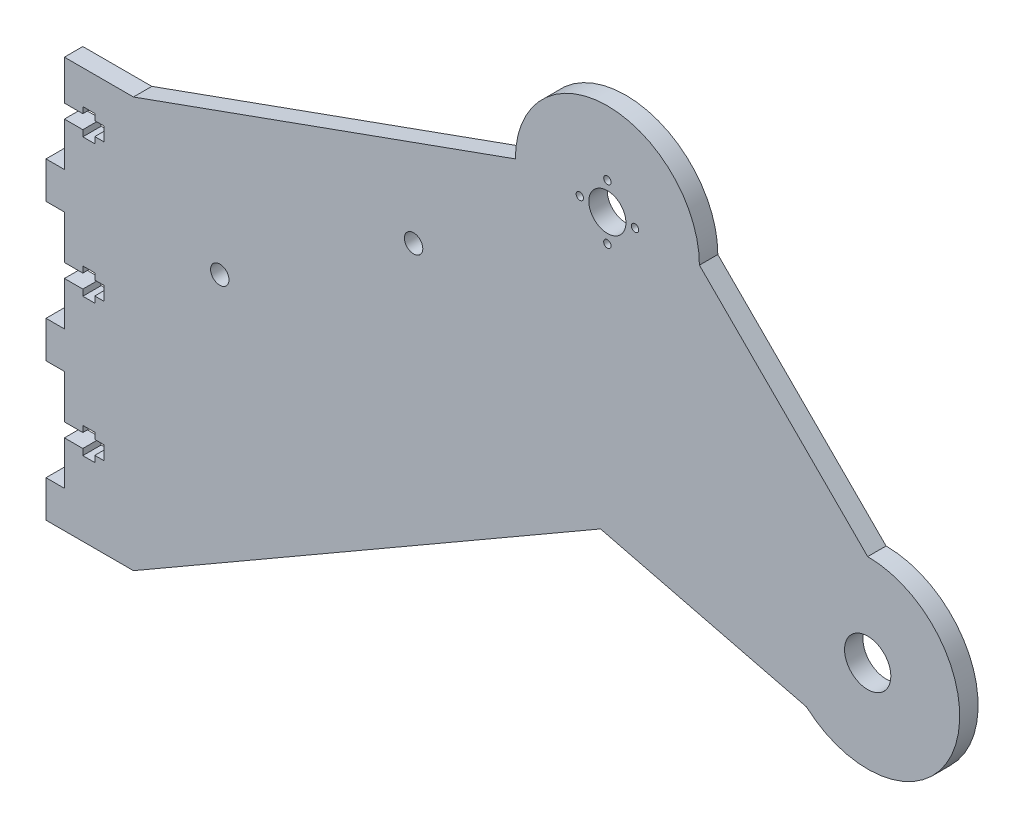
from build123d import *

# Parameters (mm, degrees)
SKETCH_1_R      = 2
SKETCH_1_R_2    = 5.03
SKETCH_1_R_3    = 0.8
SKETCH_1_R_4    = 4.03
EXTRUDE_1_DEPTH = 4


with BuildPart() as part:
    # 草图1 → 凸台-拉伸1 (new body)
    with BuildSketch(Plane.XY):
        with BuildLine():
            Line((2.282857143, -22.113571429), (-1.717142857, -22.113571429))
            Line((-1.717142857, -22.113571429), (-1.717142857, -31.613571429))
            Line((-1.717142857, -31.613571429), (-5.717142857, -31.613571429))
            Line((-5.717142857, -31.613571429), (-5.717142857, -39.613571429))
            Line((-5.717142857, -39.613571429), (-1.717142857, -39.613571429))
            Line((-1.717142857, -39.613571429), (13.282857143, -39.613571429))
            Line((13.282857143, -39.613571429), (114.795824144, 18.994967396))
            Line((114.795824144, 18.994967396), (159.545326709, 7.886428571))
            ThreePointArc((159.545326709, 7.886428571), (191.541358842, 15.698516375), (172.851399638, 42.817886077))
            Line((172.851399638, 42.817886077), (136.282857143, 79.386428571))
            ThreePointArc((136.282857143, 79.386428571), (116.282857143, 99.386428571), (96.282857143, 79.386428571))
            Line((96.282857143, 79.386428571), (13.282857143, 49.538084372))
            Line((13.282857143, 49.538084372), (-1.717142857, 49.538084372))
            Line((-1.717142857, 49.538084372), (-1.717142857, 40.886428571))
            Line((-1.717142857, 40.886428571), (2.282857143, 40.886428571))
            Line((2.282857143, 40.886428571), (2.282857143, 42.236428571))
            Line((2.282857143, 42.236428571), (4.882857143, 42.236428571))
            Line((4.882857143, 42.236428571), (4.882857143, 40.886428571))
            Line((4.882857143, 40.886428571), (6.882857143, 40.886428571))
            Line((6.882857143, 40.886428571), (6.882857143, 37.886428571))
            Line((6.882857143, 37.886428571), (4.882857143, 37.886428571))
            Line((4.882857143, 37.886428571), (4.882857143, 36.536428571))
            Line((4.882857143, 36.536428571), (2.282857143, 36.536428571))
            Line((2.282857143, 36.536428571), (2.282857143, 37.886428571))
            Line((2.282857143, 37.886428571), (-1.717142857, 37.886428571))
            Line((-1.717142857, 37.886428571), (-1.717142857, 28.386428571))
            Line((-1.717142857, 28.386428571), (-5.717142857, 28.386428571))
            Line((-5.717142857, 28.386428571), (-5.717142857, 20.386428571))
            Line((-5.717142857, 20.386428571), (-1.717142857, 20.386428571))
            Line((-1.717142857, 20.386428571), (-1.717142857, 10.886428571))
            Line((-1.717142857, 10.886428571), (2.282857143, 10.886428571))
            Line((2.282857143, 10.886428571), (2.282857143, 12.236428571))
            Line((2.282857143, 12.236428571), (4.882857143, 12.236428571))
            Line((4.882857143, 12.236428571), (4.882857143, 10.886428571))
            Line((4.882857143, 10.886428571), (6.882857143, 10.886428571))
            Line((6.882857143, 10.886428571), (6.882857143, 7.886428571))
            Line((6.882857143, 7.886428571), (4.882857143, 7.886428571))
            Line((4.882857143, 7.886428571), (4.882857143, 6.536428571))
            Line((4.882857143, 6.536428571), (2.282857143, 6.536428571))
            Line((2.282857143, 6.536428571), (2.282857143, 7.886428571))
            Line((2.282857143, 7.886428571), (-1.717142857, 7.886428571))
            Line((-1.717142857, 7.886428571), (-1.717142857, -1.613571429))
            Line((-1.717142857, -1.613571429), (-5.717142857, -1.613571429))
            Line((-5.717142857, -1.613571429), (-5.717142857, -9.613571429))
            Line((-5.717142857, -9.613571429), (-1.717142857, -9.613571429))
            Line((-1.717142857, -9.613571429), (-1.717142857, -19.113571429))
            Line((-1.717142857, -19.113571429), (2.282857143, -19.113571429))
            Line((2.282857143, -19.113571429), (2.282857143, -17.763571429))
            Line((2.282857143, -17.763571429), (4.882857143, -17.763571429))
            Line((4.882857143, -17.763571429), (4.882857143, -19.113571429))
            Line((4.882857143, -19.113571429), (6.882857143, -19.113571429))
            Line((6.882857143, -19.113571429), (6.882857143, -22.113571429))
            Line((6.882857143, -22.113571429), (4.882857143, -22.113571429))
            Line((4.882857143, -22.113571429), (4.882857143, -23.463571429))
            Line((4.882857143, -23.463571429), (2.282857143, -23.463571429))
            Line((2.282857143, -23.463571429), (2.282857143, -22.113571429))
        make_face()
        with Locations((32.050124236, 25.489798741)):
            Circle(SKETCH_1_R, mode=Mode.SUBTRACT)
        with Locations((172.851399638, 22.817886077)):
            Circle(SKETCH_1_R_2, mode=Mode.SUBTRACT)
        with Locations((74.16649069, 52.438113656)):
            Circle(SKETCH_1_R, mode=Mode.SUBTRACT)
        with Locations((116.282857143, 73.386428571)):
            Circle(SKETCH_1_R_3, mode=Mode.SUBTRACT)
        with Locations((110.282857143, 79.386428571)):
            Circle(SKETCH_1_R_3, mode=Mode.SUBTRACT)
        with Locations((116.282857143, 79.386428571)):
            Circle(SKETCH_1_R_4, mode=Mode.SUBTRACT)
        with Locations((122.282857143, 79.386428571)):
            Circle(SKETCH_1_R_3, mode=Mode.SUBTRACT)
        with Locations((116.282857143, 85.386428571)):
            Circle(SKETCH_1_R_3, mode=Mode.SUBTRACT)
    extrude(amount=EXTRUDE_1_DEPTH)


solid = part.part
